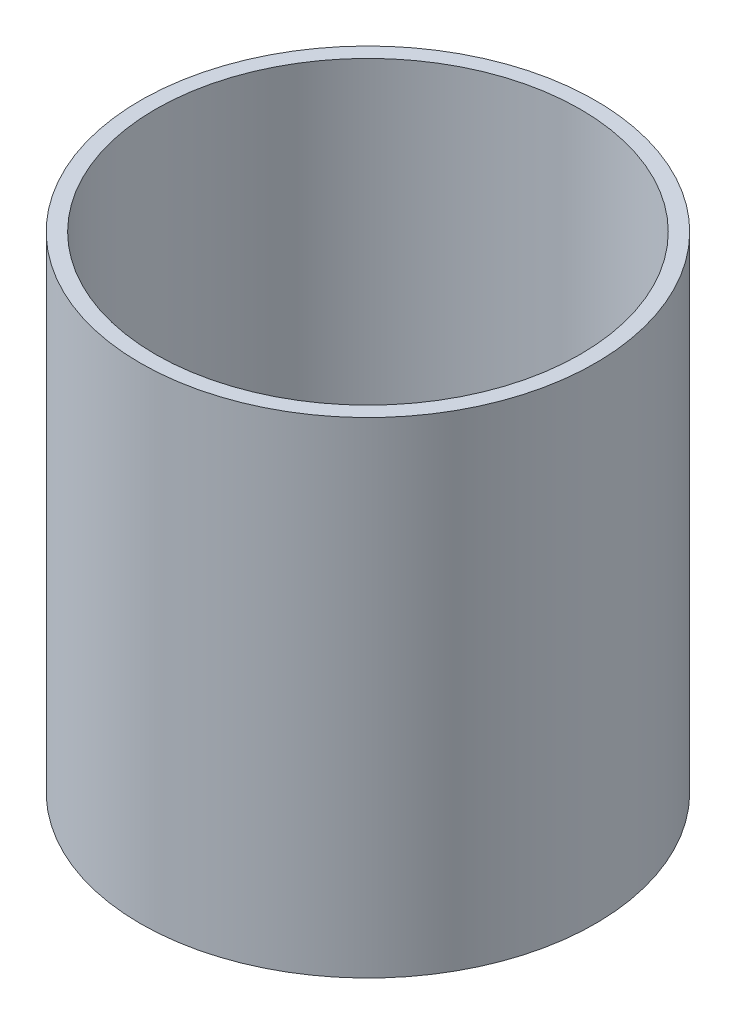
from build123d import *

# Parameters (mm, degrees)
GOBLET_SHELL_T                     = -4
SKETCH2_R                          = 44
CUT_TO_FIT_WITH_BLADE_CASING_DEPTH = 10


with BuildPart() as part:
    # Sketch1 → Goblet Revolve (revolve)
    with BuildSketch(Plane.XY, mode=Mode.PRIVATE) as goblet_revolve_sk:
        Polygon((0, 0), (48, 0), (48, 8), (60, 8), (60, 136), (0, 136), align=None)
    revolve(goblet_revolve_sk.sketch.rotate(Axis((0, 136, 0), (0, -1, 0)), 90), axis=Axis((0, 136, 0), (0, -1, 0)))

    # Goblet Shell
    goblet_shell_openings = [part.faces().sort_by_distance(p)[0] for p in [
        (0, 136, 0),
    ]]
    offset(amount=GOBLET_SHELL_T, openings=goblet_shell_openings, kind=Kind.INTERSECTION)

    # Sketch2 → Cut to Fit with Blade Casing (cut)
    with BuildSketch(Plane(origin=(0, 4, 0), x_dir=(1, 0, 0), z_dir=(0, 1, 0))):
        with Locations(Location((0, 0, 0), (0, 0, 270))):
            Circle(SKETCH2_R)
    extrude(amount=-CUT_TO_FIT_WITH_BLADE_CASING_DEPTH, mode=Mode.SUBTRACT)


solid = part.part
